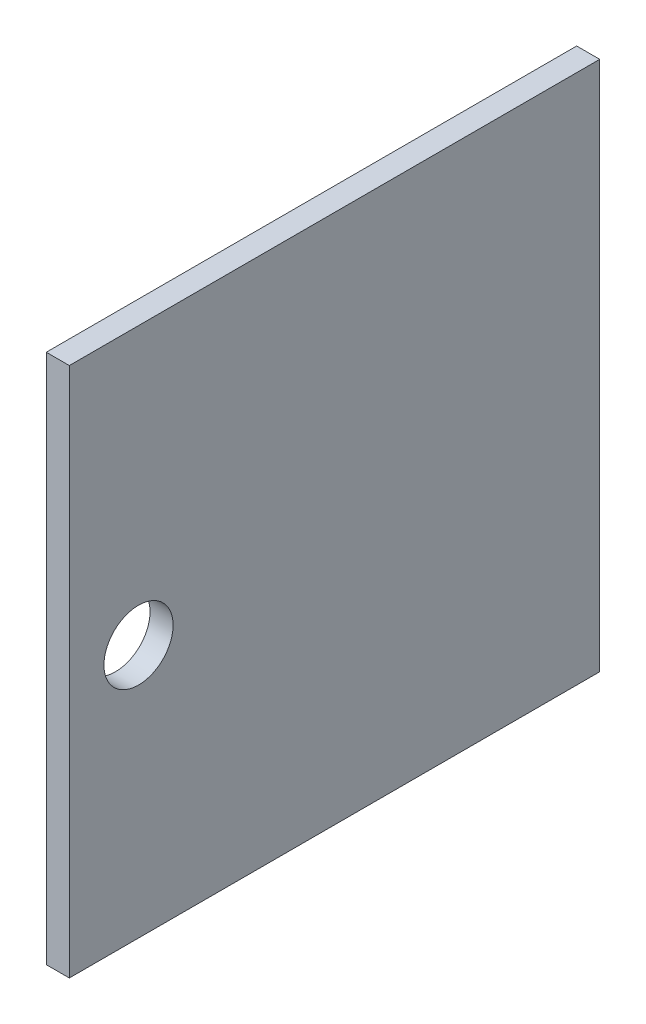
from build123d import *

# Parameters (mm, degrees)
SKETCH_1_W      = 115
SKETCH_1_H      = 115
SKETCH_1_R      = 7.5
EXTRUDE_1_DEPTH = 5


with BuildPart() as part:
    # 草圖1 → 填料-伸長1 (new body)
    with BuildSketch(Plane(origin=(0, 0, 0), x_dir=(0, 0, -1), z_dir=(1, 0, 0))):
        with Locations((19.013157895, 51.611842105)):
            Rectangle(SKETCH_1_W, SKETCH_1_H)
        with Locations((-23.486842105, 49.111842105)):
            Circle(SKETCH_1_R, mode=Mode.SUBTRACT)
    extrude(amount=-EXTRUDE_1_DEPTH)


solid = part.part
